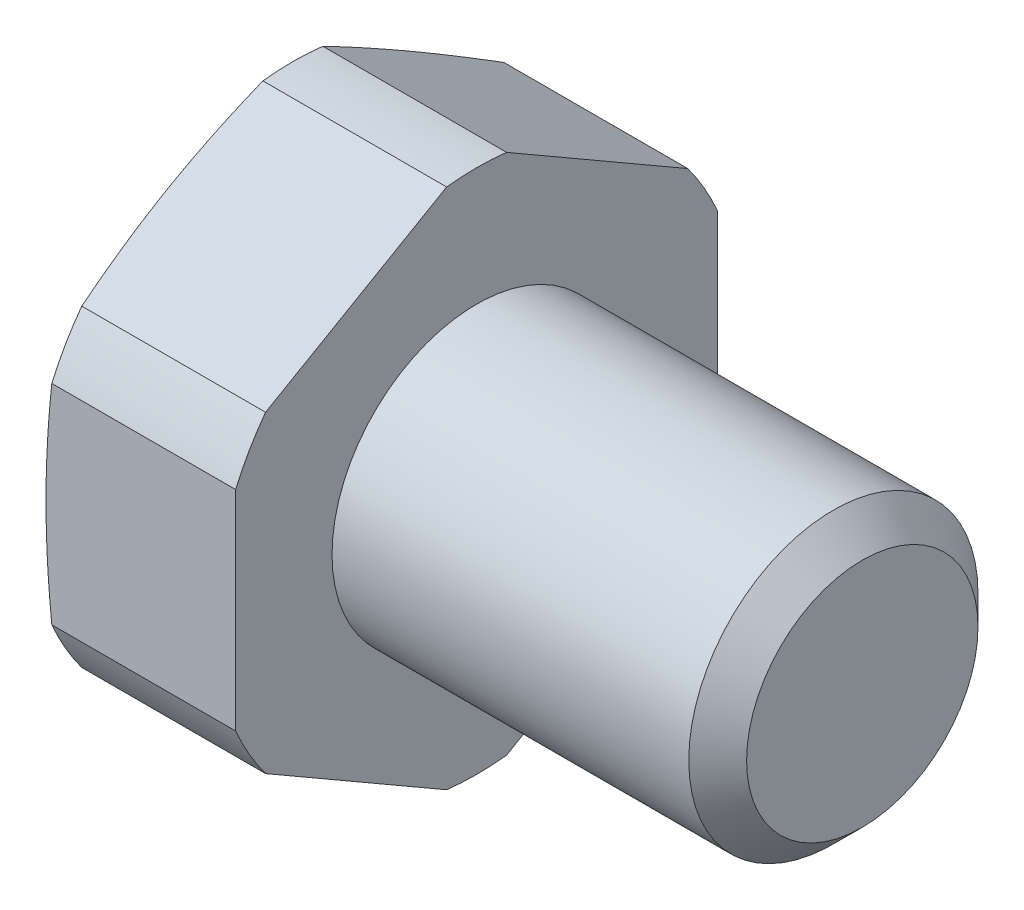
from build123d import *

# Parameters (mm, degrees)
SKETCH_2_OUTSIDE_W  = 16.808
SKETCH_2_OUTSIDE_H  = 16.808
CUT_EXTRUDE_1_DEPTH = 12


with BuildPart() as part:
    # Эскиз1 → Повернуть1 (revolve)
    with BuildSketch(Plane.XY, mode=Mode.PRIVATE) as revolve_1_sk:
        Polygon((-4, 0), (-4, 4.75), (-3.812435565, 5.45), (0, 5.45), (0, 3), (7.4, 3), (8, 2.4), (8, 0), align=None)
    revolve(revolve_1_sk.sketch.rotate(Axis((-1000, 0, 0), (1, 0, 0)), 90), axis=Axis((-1000, 0, 0), (1, 0, 0)))

    # Эскиз2 outside → Вырез-Вытянуть1 (cut)
    with BuildSketch(Plane.ZY.offset(4)):
        Rectangle(SKETCH_2_OUTSIDE_W, SKETCH_2_OUTSIDE_H)
        Polygon((0, 5.773502692), (-5, 2.886751346), (-5, -2.886751346), (0, -5.773502692), (5, -2.886751346), (5, 2.886751346), align=None, mode=Mode.SUBTRACT)
    extrude(amount=-CUT_EXTRUDE_1_DEPTH, mode=Mode.SUBTRACT)


solid = part.part
